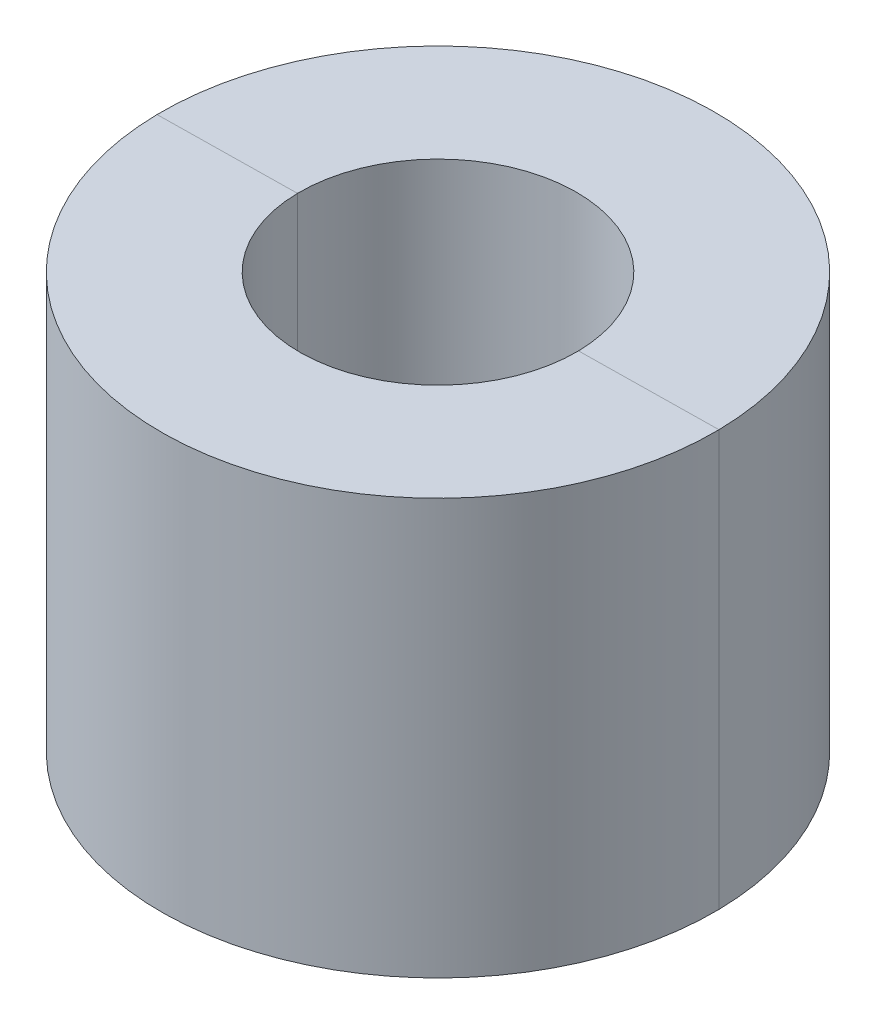
from build123d import *

# Parameters (mm, degrees)
SKETCH1_R              = 20
SKETCH1_R_2            = 10
EXTRUDE_THIN1_DEPTH    = 30
SPLIT1_SURFACE_1_BACK  = 65.031
SPLIT1_SURFACE_1_DEPTH = 130.062
SPLIT1_SURFACE_2_BACK  = 65.031
SPLIT1_SURFACE_2_DEPTH = 130.062


with BuildPart() as part:
    # Sketch1 → Extrude-Thin1 (new body)
    with BuildSketch(Plane(origin=(0, 0, 0), x_dir=(1, 0, 0), z_dir=(0, 1, 0))):
        Circle(SKETCH1_R)
        Circle(SKETCH1_R_2, mode=Mode.SUBTRACT)
    extrude(amount=EXTRUDE_THIN1_DEPTH)


with BuildPart() as body_2:
    # Split1: the piece behind the surface
    add(part.part)
    # Split1 surface: a surface, the sketch's curves swept straight by 130.062 mm
    with BuildLine(Plane(origin=(0, 30, 0), x_dir=(1, 0, 0), z_dir=(0, 1, 0)).offset(-SPLIT1_SURFACE_1_BACK), mode=Mode.PRIVATE) as split1_surface_1_path:
        Line((-26.512584697, -0.386394172), (28.829591237, 0.420162204))
    split1_surface_1 = Shell.extrude(split1_surface_1_path.wire(), (0 * SPLIT1_SURFACE_1_DEPTH, 1 * SPLIT1_SURFACE_1_DEPTH, 0 * SPLIT1_SURFACE_1_DEPTH))
    split(bisect_by=split1_surface_1, keep=Keep.BOTTOM)


with BuildPart() as part_1:
    add(part.part)

    # Split1: split by a surface, the side it looks to stays
    # Split1 surface: a surface, the sketch's curves swept straight by 130.062 mm
    with BuildLine(Plane(origin=(0, 30, 0), x_dir=(1, 0, 0), z_dir=(0, 1, 0)).offset(-SPLIT1_SURFACE_2_BACK), mode=Mode.PRIVATE) as split1_surface_2_path:
        Line((-26.512584697, -0.386394172), (28.829591237, 0.420162204))
    split1_surface_2 = Shell.extrude(split1_surface_2_path.wire(), (0 * SPLIT1_SURFACE_2_DEPTH, 1 * SPLIT1_SURFACE_2_DEPTH, 0 * SPLIT1_SURFACE_2_DEPTH))
    split(bisect_by=split1_surface_2, keep=Keep.TOP)


solid = Compound([body_2.part, part_1.part])
